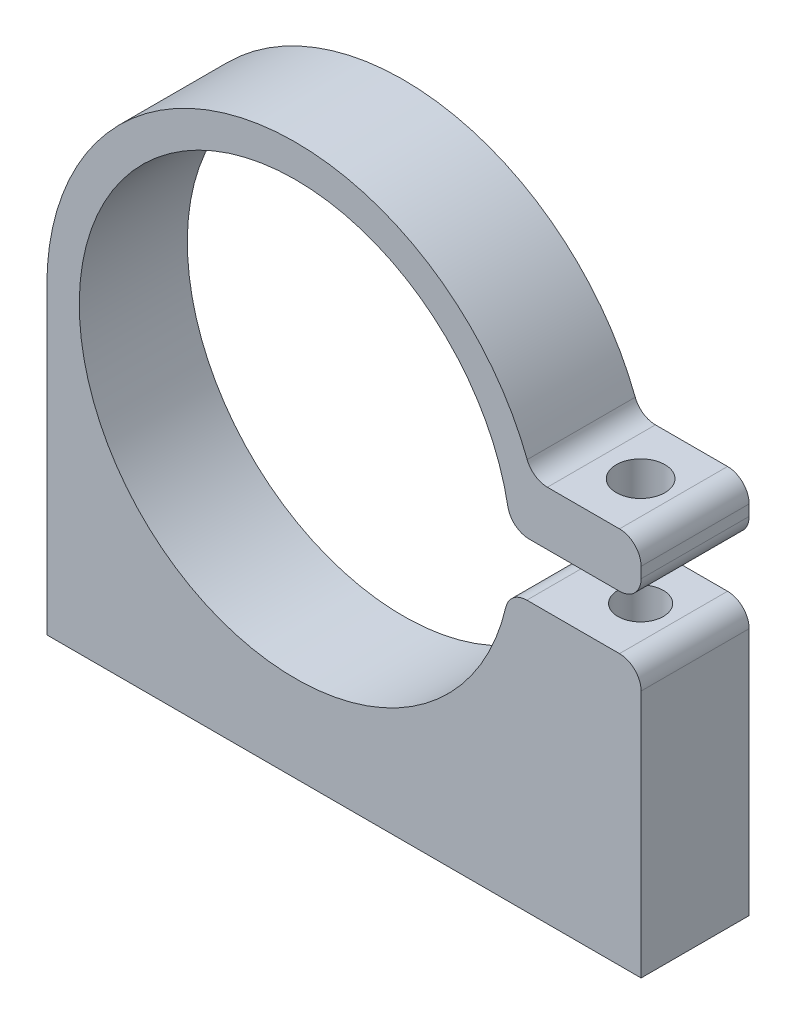
from build123d import *

# Parameters (mm, degrees)
EXTRUDE_1_DEPTH       = 10
FILLET_1_R            = 2
HOLE_WIZARD_M41_D     = 4.5
HOLE_WIZARD_M41_DEPTH = 5
M5X0_81_D             = 4.2
M5X0_82_D             = 4.2
M5X0_82_DEPTH         = 10
M5X0_82_TIP           = 1.2618073


with BuildPart() as part:
    # Эскиз1 → Бобышка-Вытянуть1 (new body)
    with BuildSketch(Plane.XY):
        with BuildLine():
            Line((32, -3), (19.773719933, -3))
            ThreePointArc((19.773719933, -3), (-19.993649721, 0.503955172), (19.899748742, 2))
            Line((19.899748742, 2), (32, 2))
            Line((32, 2), (32, 7))
            Line((32, 7), (21.9089023, 7))
            ThreePointArc((21.9089023, 7), (-3.54226249, 22.725588583), (-23, 0))
            Line((-23, 0), (-23, -28))
            Line((-23, -28), (32, -28))
            Line((32, -28), (32, -3))
        make_face()
    extrude(amount=EXTRUDE_1_DEPTH)

    # Скругление1
    fillet_1_edges = [part.edges().sort_by_distance(p)[0] for p in [
        (21.9089023, 7, 5),
        (32, 7, 5),
        (32, 2, 5),
        (19.899748742, 2, 5),
        (19.773719933, -3, 5),
        (32, -3, 5),
    ]]
    fillet(fillet_1_edges, radius=FILLET_1_R)

    # Отверстие с зазором M41
    with Locations(Plane(origin=(0, 7, 0), x_dir=(1, 0, 0), z_dir=(0, 1, 0))):
        with Locations((26.95445115, -5)):
            Hole(HOLE_WIZARD_M41_D / 2, depth=HOLE_WIZARD_M41_DEPTH)

    # Отверстие обработанное метчиком M5x0.81 (through all)
    with Locations(Plane(origin=(0, -3, 0), x_dir=(1, 0, 0), z_dir=(0, 1, 0))):
        with Locations((26.95445115, -5)):
            Hole(M5X0_81_D / 2)

    # Отверстие обработанное метчиком M5x0.82
    with Locations(Plane(origin=(0, -28, 0), x_dir=(-1, 0, 0), z_dir=(0, -1, 0))):
        with Locations((15, -5)):
            Hole(M5X0_82_D / 2, depth=M5X0_82_DEPTH)
            with Locations((0, 0, -(M5X0_82_DEPTH + M5X0_82_TIP / 2))):  # 118° drill point
                Cone(0, M5X0_82_D / 2, M5X0_82_TIP, mode=Mode.SUBTRACT)


solid = part.part
